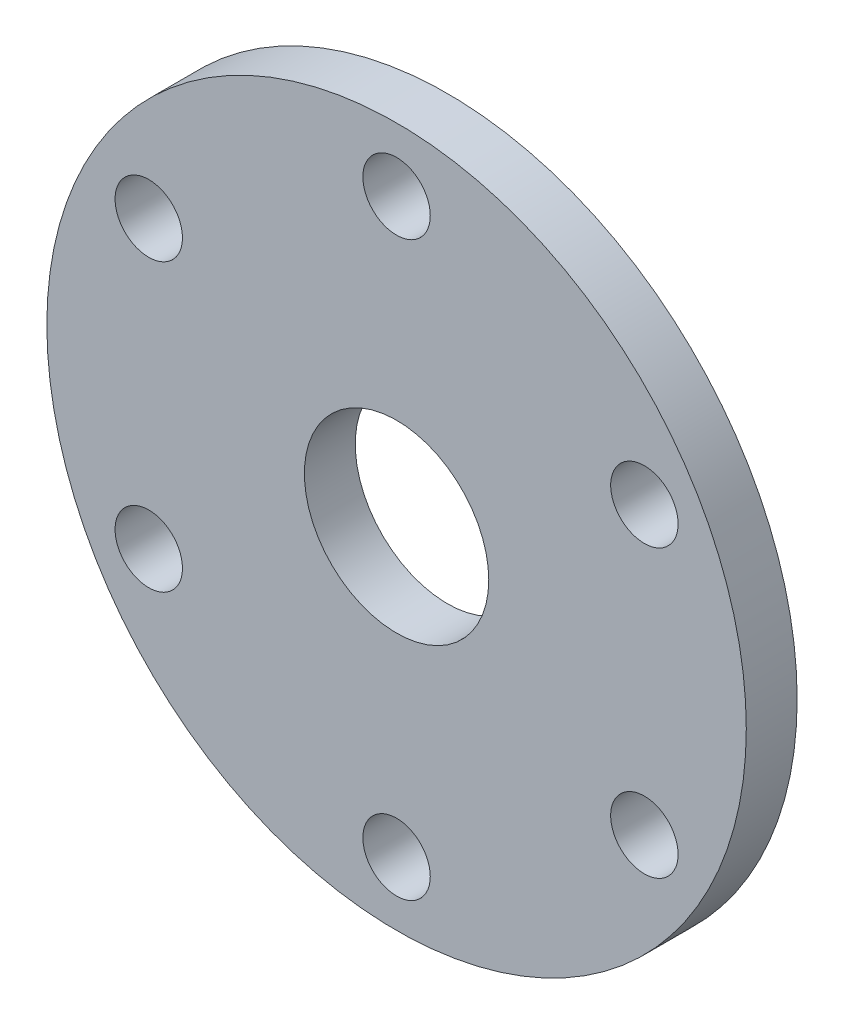
from build123d import *

# Parameters (mm, degrees)
SKETCH1_R           = 27.5
SKETCH1_R_2         = 2.65
BOSS_EXTRUDE1_DEPTH = 4
SKETCH2_R           = 7.25
CUT_EXTRUDE1_DEPTH  = 40.096035605


with BuildPart() as part:
    # Sketch1 → Boss-Extrude1 (new body)
    with BuildSketch(Plane.XY):
        Circle(SKETCH1_R)
        with Locations((0, 22.5)):
            Circle(SKETCH1_R_2, mode=Mode.SUBTRACT)
        with Locations((19.485571585, 11.25)):
            Circle(SKETCH1_R_2, mode=Mode.SUBTRACT)
        with Locations((19.485571585, -11.25)):
            Circle(SKETCH1_R_2, mode=Mode.SUBTRACT)
        with Locations((0, -22.5)):
            Circle(SKETCH1_R_2, mode=Mode.SUBTRACT)
        with Locations((-19.485571585, -11.25)):
            Circle(SKETCH1_R_2, mode=Mode.SUBTRACT)
        with Locations((-19.485571585, 11.25)):
            Circle(SKETCH1_R_2, mode=Mode.SUBTRACT)
    extrude(amount=BOSS_EXTRUDE1_DEPTH)

    # Sketch2 → Cut-Extrude1 (cut, through all)
    with BuildSketch(Plane.XY.offset(4)):
        Circle(SKETCH2_R)
    extrude(amount=-CUT_EXTRUDE1_DEPTH, mode=Mode.SUBTRACT)


solid = part.part
